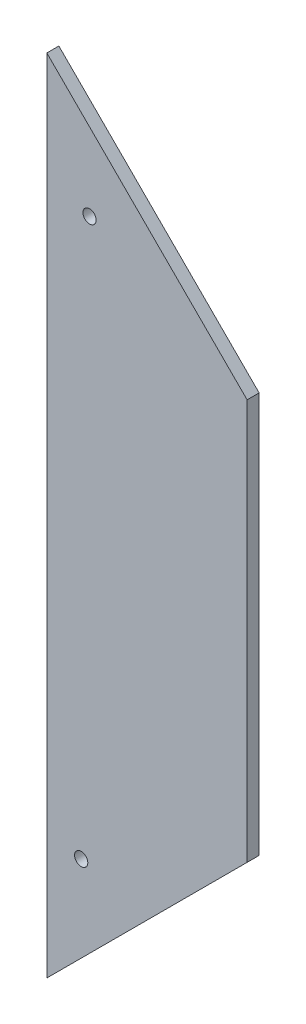
from build123d import *

# Parameters (mm, degrees)
EXTRUDE_1_DEPTH     = 3
SKETCH_5_R          = 1.65
CUT_EXTRUDE_1_DEPTH = 8


with BuildPart() as part:
    # Эскиз1 → Бобышка-Вытянуть1 (new body)
    with BuildSketch(Plane.XY):
        Polygon((0, 0), (0, 200), (50, 150), (50, 50), align=None)
    extrude(amount=EXTRUDE_1_DEPTH)

    # Эскиз5 → Вырез-Вытянуть1 (cut)
    with BuildSketch(Plane(origin=(-305.961161651, -184.204468703, -1.5), x_dir=(-0.9998892265297747, 0.01488404077153568, 0), z_dir=(0, 0, -1))):
        with BuildLine():
            ThreePointArc((-309.659295343, 358.877763083), (-310.142569154, 360.044489272), (-311.309295343, 360.527763083))
            Line((-311.309295343, 360.527763083), (-311.309295343, 357.227763083))
            ThreePointArc((-311.309295343, 357.227763083), (-310.142569154, 357.711036894), (-309.659295343, 358.877763083))
        make_face()
        with BuildLine():
            Line((-311.309295343, 357.227763083), (-311.309295343, 360.527763083))
            ThreePointArc((-311.309295343, 360.527763083), (-312.959295343, 358.877763083), (-311.309295343, 357.227763083))
        make_face()
        with Locations(Location((-311.309295343, 218.877763083, 0), (0, 0, 179.147175791))):
            Circle(SKETCH_5_R)
    extrude(amount=-CUT_EXTRUDE_1_DEPTH, mode=Mode.SUBTRACT)


solid = part.part
